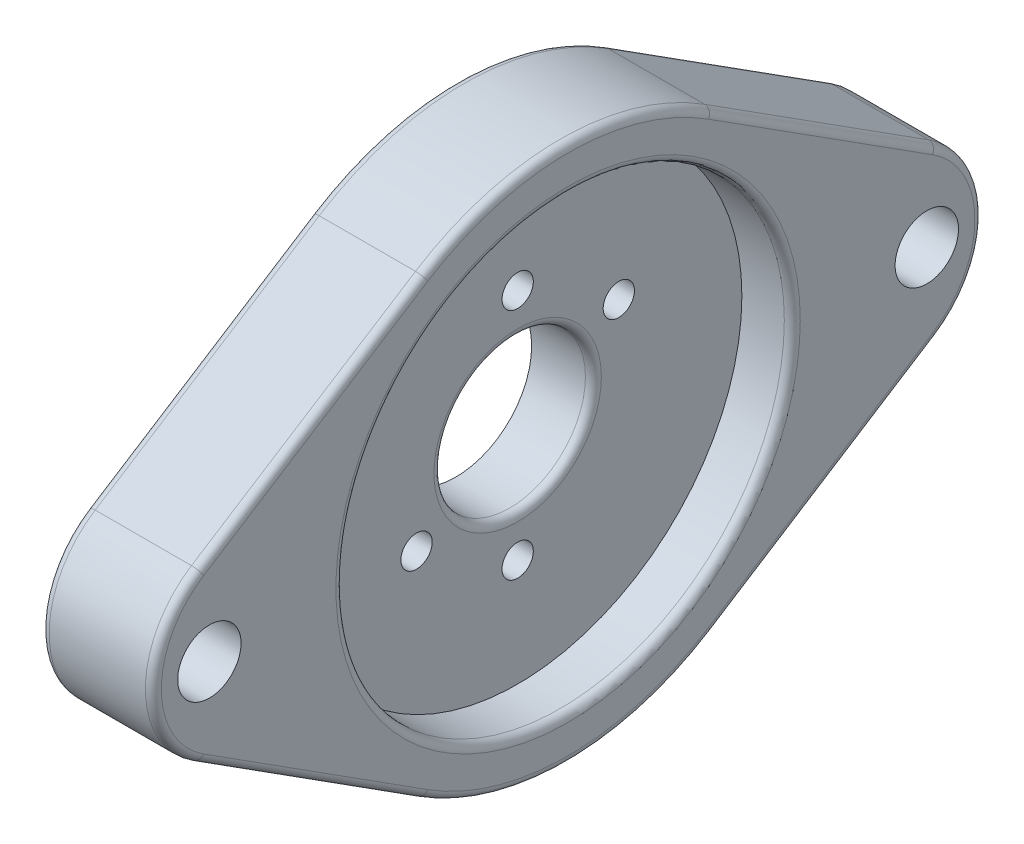
from build123d import *

# Parameters (mm, degrees)
BOSS_EXTRUDE3_DEPTH        = 7.1501
SKETCH5_R                  = 4.826
CUT_EXTRUDE4_DEPTH         = 33.306330486
SKETCH6_R                  = 14.2875
CUT_EXTRUDE5_DEPTH         = 3.2131
TAP_DRILL_FOR_3_48_TAP2_D  = 1.9939
TAP_DRILL_FOR_10_32_TAP3_D = 4.0386
FILLET3_R                  = 0.508
FILLET4_R                  = 0.508
FILLET5_R                  = 0.508
FILLET6_R                  = 0.508


with BuildPart() as part:
    # Sketch1 → Boss-Extrude3 (new body)
    with BuildSketch(Plane(origin=(0, 0, 0), x_dir=(0, 0, -1), z_dir=(1, 0, 0))):
        with BuildLine():
            Line((9.216458059, 14.457106413), (23.495, 5.354483857))
            ThreePointArc((23.495, 5.354483857), (26.431497015, 0), (23.495, -5.354483857))
            Line((23.495, -5.354483857), (9.216458059, -14.457106413))
            ThreePointArc((9.216458059, -14.457106413), (0, -17.145), (-9.216458059, -14.457106413))
            Line((-9.216458059, -14.457106413), (-23.495, -5.354483857))
            ThreePointArc((-23.495, -5.354483857), (-26.431497015, 0), (-23.495, 5.354483857))
            Line((-23.495, 5.354483857), (-9.216458059, 14.457106413))
            ThreePointArc((-9.216458059, 14.457106413), (0, 17.145), (9.216458059, 14.457106413))
        make_face()
    extrude(amount=BOSS_EXTRUDE3_DEPTH)

    # Sketch5 → Cut-Extrude4 (cut, through all)
    with BuildSketch(Plane(origin=(7.1501, 0, 0), x_dir=(0, 0, -1), z_dir=(1, 0, 0))):
        Circle(SKETCH5_R)
    extrude(amount=-CUT_EXTRUDE4_DEPTH, mode=Mode.SUBTRACT)

    # Sketch6 → Cut-Extrude5 (cut)
    with BuildSketch(Plane(origin=(7.1501, 0, 0), x_dir=(0, 0, -1), z_dir=(1, 0, 0))):
        Circle(SKETCH6_R)
    extrude(amount=-CUT_EXTRUDE5_DEPTH, mode=Mode.SUBTRACT)

    # Tap Drill for #3-48 Tap2 (through all)
    with Locations(Plane(origin=(3.937, 0, 0), x_dir=(0, 0, -1), z_dir=(1, 0, 0))):
        with Locations((0, 7.4422), (0, -7.4422), (6.44513426, 3.7211), (-6.44513426, -3.7211)):
            Hole(TAP_DRILL_FOR_3_48_TAP2_D / 2)

    # Tap Drill for #10-32 Tap3 (through all)
    with Locations(Plane(origin=(7.1501, 0, 0), x_dir=(0, 0, -1), z_dir=(1, 0, 0))):
        with Locations((-22.86, 0), (22.86, 0)):
            Hole(TAP_DRILL_FOR_10_32_TAP3_D / 2)

    # Fillet3
    fillet3_edges = [part.edges().sort_by_distance(p)[0] for p in [
        (7.1501, 0, 14.2875),
    ]]
    fillet(fillet3_edges, radius=FILLET3_R)

    # Fillet4
    fillet4_edges = [part.edges().sort_by_distance(p)[0] for p in [
        (3.937, 0, 4.826),
    ]]
    fillet(fillet4_edges, radius=FILLET4_R)

    # Fillet5
    fillet5_edges = [part.edges().sort_by_distance(p)[0] for p in [
        (7.1501, 0, 26.431497015),
        (7.1501, -9.905795135, 16.355729029),
        (7.1501, -17.145, 0),
        (7.1501, -9.905795135, -16.355729029),
        (7.1501, 0, -26.431497015),
        (7.1501, 9.905795135, -16.355729029),
        (7.1501, 17.145, 0),
        (7.1501, 9.905795135, 16.355729029),
    ]]
    fillet(fillet5_edges, radius=FILLET5_R)

    # Fillet6
    fillet6_edges = [part.edges().sort_by_distance(p)[0] for p in [
        (0, 9.905795135, 16.355729029),
        (0, 17.145, 0),
        (0, 9.905795135, -16.355729029),
        (0, 0, -26.431497015),
        (0, -9.905795135, -16.355729029),
        (0, -17.145, 0),
        (0, -9.905795135, 16.355729029),
        (0, 0, 26.431497015),
    ]]
    fillet(fillet6_edges, radius=FILLET6_R)


solid = part.part
